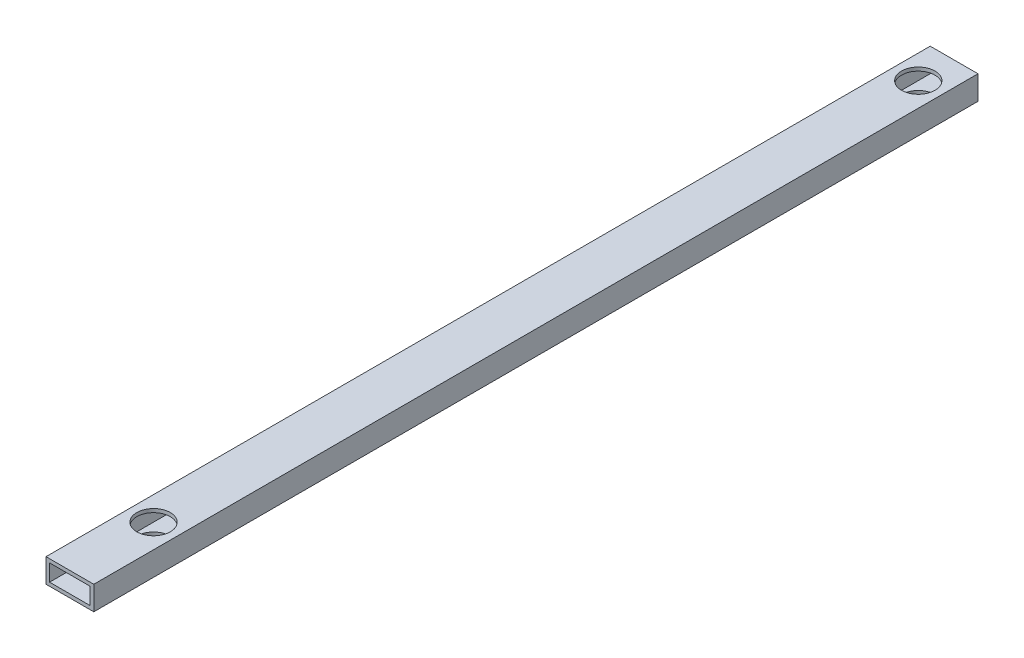
from build123d import *

# Parameters (mm, degrees)
SKETCH_1_W          = 20
SKETCH_1_H          = 10
SKETCH_1_W_2        = 17
SKETCH_1_H_2        = 7
EXTRUDE_1_DEPTH     = 370
SKETCH_2_R          = 7
CUT_EXTRUDE_1_DEPTH = 280


with BuildPart() as part:
    # 草图1 → 凸台-拉伸1 (new body)
    with BuildSketch(Plane.XY):
        Rectangle(SKETCH_1_W, SKETCH_1_H)
        Rectangle(SKETCH_1_W_2, SKETCH_1_H_2, mode=Mode.SUBTRACT)
    extrude(amount=EXTRUDE_1_DEPTH)

    # 草图2 → 切除-拉伸1 (cut)
    with BuildSketch(Plane(origin=(0, 5, 0), x_dir=(1, 0, 0), z_dir=(0, 1, 0))):
        with Locations(Location((0, -15, 0), (0, 0, 270))):
            Circle(SKETCH_2_R)
        with Locations(Location((0, -335, 0), (0, 0, 270))):
            Circle(SKETCH_2_R)
    extrude(amount=-CUT_EXTRUDE_1_DEPTH, mode=Mode.SUBTRACT)


solid = part.part
